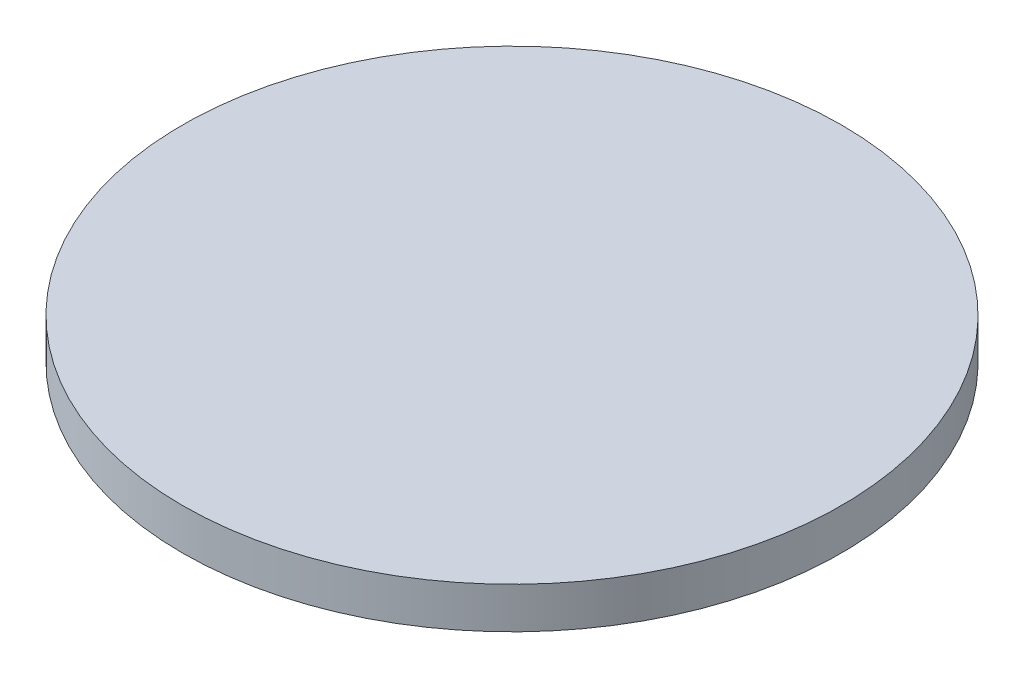
from build123d import *

# Parameters (mm, degrees)
SKETCH_1_R        = 8
EXTRUDE_220_DEPTH = 1


with BuildPart() as part:
    # Эскиз1 → Extrude 220 (new body)
    with BuildSketch(Plane(origin=(0, 0, 0), x_dir=(1, 0, 0), z_dir=(0, 1, 0))):
        with Locations(Location((0, 0, 0), (0, 0, 270))):
            Circle(SKETCH_1_R)
    extrude(amount=EXTRUDE_220_DEPTH)


solid = part.part
